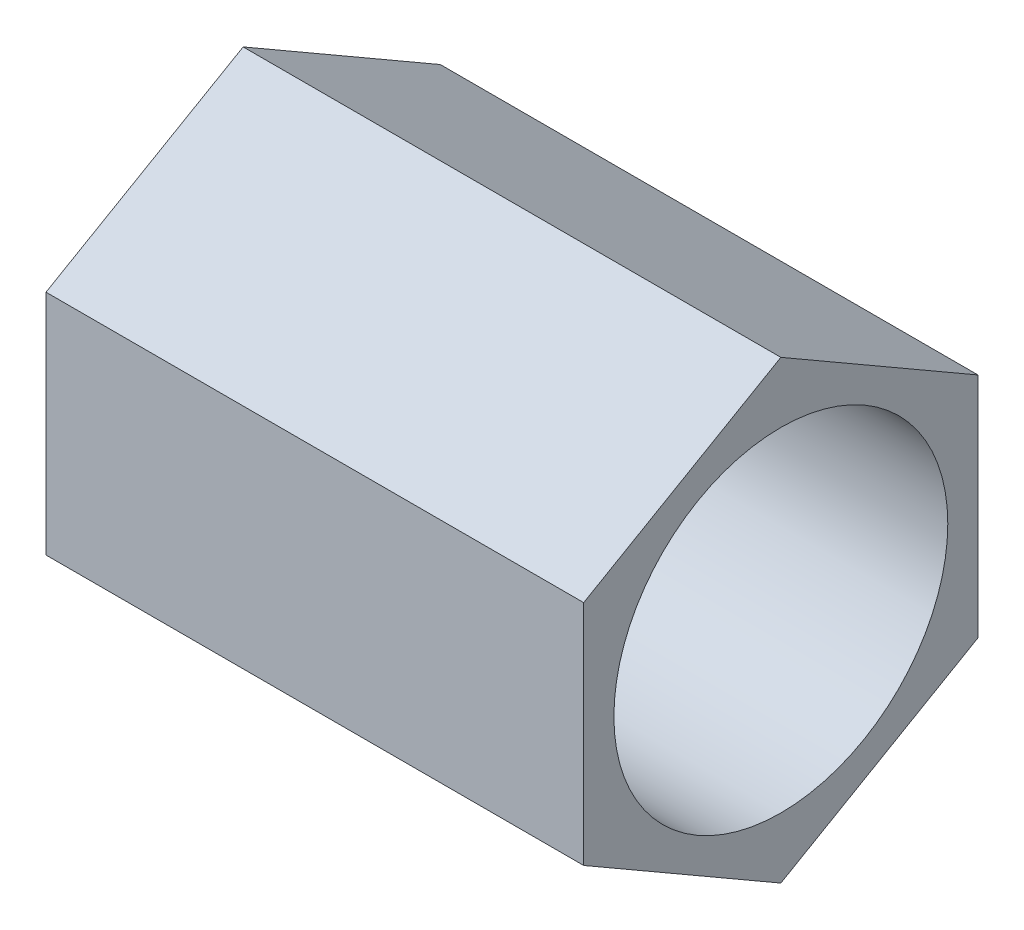
from build123d import *

# Parameters (mm, degrees)
SCHNITT_LINEAR_AUSTRAGEN2_DEPTH = 26.980762114
KREISMUSTER1_COUNT              = 6


with BuildPart() as part:
    # Skizze2 → Rotation1 (revolve)
    with BuildSketch(Plane.XY, mode=Mode.PRIVATE) as rotation1_sk:
        Polygon((-15, 13.5), (-14.598076211, 15), (14.598076211, 15), (15, 13.5), (15, 9.315), (-15, 9.315), align=None)
    revolve(rotation1_sk.sketch.rotate(Axis((-12.825745381, 0, 0), (1, 0, 0)), 90), axis=Axis((-12.825745381, 0, 0), (1, 0, 0)))

    # Skizze3 → Schnitt-Linear austragen2 (cut, symmetric)
    with BuildSketch(Plane(origin=(0, 0, 0), x_dir=(0, 0, -1), z_dir=(1, 0, 0))):
        with BuildLine():
            Line((11, 10.198039027), (11, -10.198039027))
            ThreePointArc((11, -10.198039027), (15, 0), (11, 10.198039027))
        make_face()
    schnitt_linear_austragen2 = extrude(amount=SCHNITT_LINEAR_AUSTRAGEN2_DEPTH, both=True, mode=Mode.SUBTRACT)

    # Kreismuster1: Schnitt-Linear austragen2 ×6 about axis
    kreismuster1_axis = Axis((0, 0, 0), (1, 0, 0))
    for i in range(1, KREISMUSTER1_COUNT):
        add(schnitt_linear_austragen2.rotate(kreismuster1_axis, i * 360 / KREISMUSTER1_COUNT), mode=Mode.SUBTRACT)


solid = part.part
